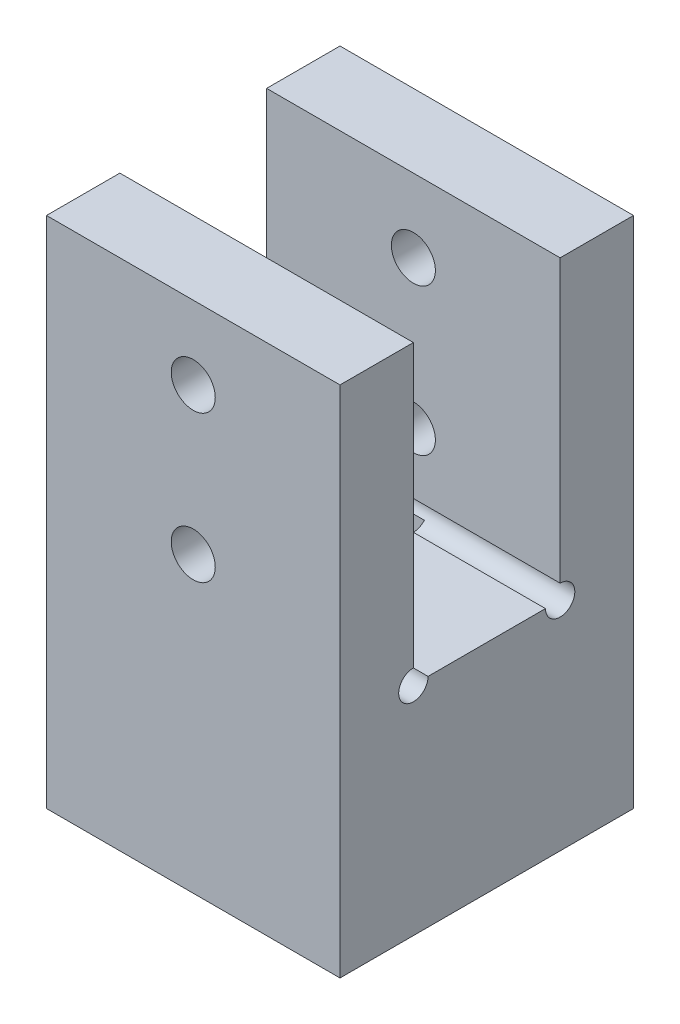
from build123d import *

# Parameters (mm, degrees)
SKETCH_1_W          = 20
SKETCH_1_H          = 35
EXTRUDE_1_DEPTH     = 5
SKETCH_2_W          = 10
SKETCH_2_H          = 14.8
EXTRUDE_2_DEPTH     = 10
SKETCH_3_W          = 20
SKETCH_3_H          = 35
EXTRUDE_3_DEPTH     = 5
SKETCH_4_R          = 1
CUT_EXTRUDE_1_DEPTH = 34.260336739
SKETCH_5_R          = 1.5
CUT_EXTRUDE_2_DEPTH = 29.394541729
SKETCH_6_W          = 11.5
SKETCH_6_H          = 14.8
CUT_EXTRUDE_3_DEPTH = 10


with BuildPart() as part:
    # ｽｹｯﾁ1 → ﾎﾞｽ - 押し出し1 (new body)
    with BuildSketch(Plane.XY):
        Rectangle(SKETCH_1_W, SKETCH_1_H)
    extrude(amount=EXTRUDE_1_DEPTH)

    # ｽｹｯﾁ2 → ﾎﾞｽ - 押し出し2 (add)
    with BuildSketch(Plane.XY.offset(5)):
        with Locations((5, -10.1)):
            Rectangle(SKETCH_2_W, SKETCH_2_H)
    extrude(amount=EXTRUDE_2_DEPTH)

    # ｽｹｯﾁ3 → ﾎﾞｽ - 押し出し3 (add)
    with BuildSketch(Plane.XY.offset(15)):
        Rectangle(SKETCH_3_W, SKETCH_3_H)
    extrude(amount=EXTRUDE_3_DEPTH)

    # ｽｹｯﾁ4 → ｶｯﾄ - 押し出し1 (cut, through all)
    with BuildSketch(Plane(origin=(10, 0, 0), x_dir=(0, 0, -1), z_dir=(1, 0, 0))):
        with Locations((-15, -2.7)):
            Circle(SKETCH_4_R)
        with Locations((-5, -2.7)):
            Circle(SKETCH_4_R)
    extrude(amount=-CUT_EXTRUDE_1_DEPTH, mode=Mode.SUBTRACT)

    # ｽｹｯﾁ5 → ｶｯﾄ - 押し出し2 (cut, through all)
    with BuildSketch(Plane.XY.offset(20)):
        with Locations((0, 12.5)):
            Circle(SKETCH_5_R)
        with Locations((0, 2.5)):
            Circle(SKETCH_5_R)
    extrude(amount=-CUT_EXTRUDE_2_DEPTH, mode=Mode.SUBTRACT)

    # ｽｹｯﾁ6 → ｶｯﾄ - 押し出し3 (cut)
    with BuildSketch(Plane.ZY):
        with Locations((10, -10.1)):
            Rectangle(SKETCH_6_W, SKETCH_6_H)
    extrude(amount=CUT_EXTRUDE_3_DEPTH, mode=Mode.SUBTRACT)


solid = part.part
